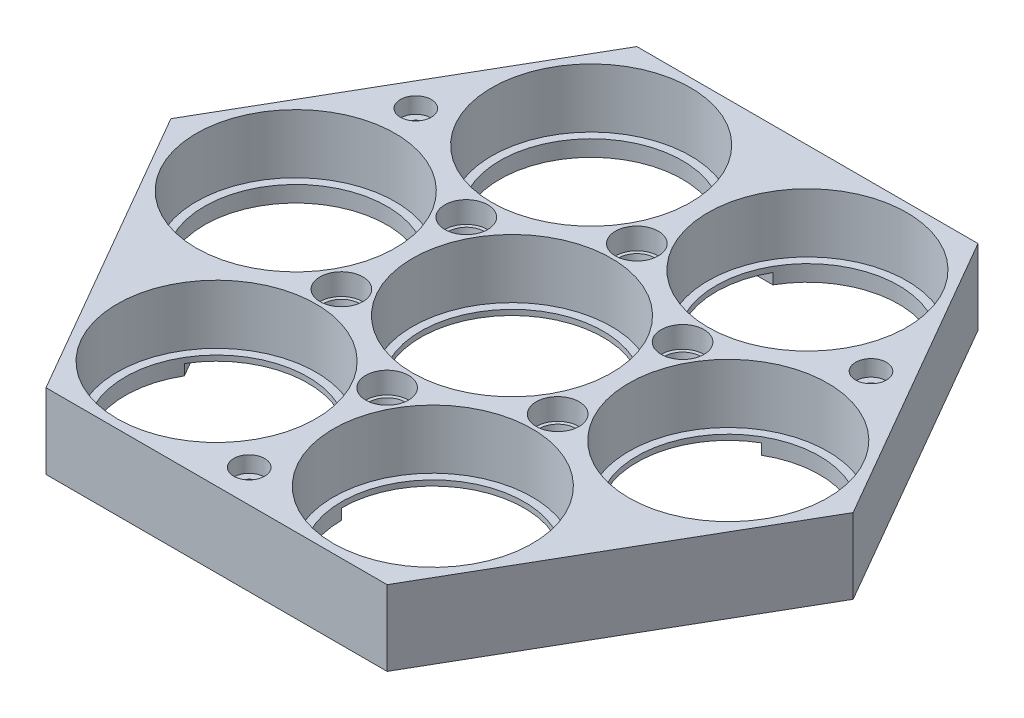
from build123d import *

# Parameters (mm, degrees)
SKETCH1_R                    = 17
BOSS_EXTRUDE1_DEPTH          = 1
SKETCH2_R                    = 18.525
BOSS_EXTRUDE2_DEPTH          = 11
CUT_EXTRUDE1_DEPTH           = 85.943417218
CUT_EXTRUDE1_DEPTH_BACK      = 4
SKETCH3_R                    = 4
SKETCH3_2_R                  = 4
CUT_EXTRUDE2_DEPTH           = 85.943417218
CUT_EXTRUDE2_DRAFT           = -9
CUT_EXTRUDE2_PROFILE_2_DEPTH = 85.943417218
CUT_EXTRUDE2_PROFILE_2_DRAFT = -9
CUT_EXTRUDE2_PROFILE_3_DEPTH = 85.943417218
CUT_EXTRUDE2_PROFILE_3_DRAFT = -9
CUT_EXTRUDE2_PROFILE_4_DEPTH = 85.943417218
CUT_EXTRUDE2_PROFILE_4_DRAFT = -9
CUT_EXTRUDE2_PROFILE_5_DEPTH = 85.943417218
CUT_EXTRUDE2_PROFILE_5_DRAFT = -9
CUT_EXTRUDE2_PROFILE_6_DEPTH = 85.943417218
CUT_EXTRUDE2_PROFILE_6_DRAFT = -9
BOSS_EXTRUDE3_START          = 2
BOSS_EXTRUDE3_DEPTH          = 2
SKETCH7_R                    = 1.55
CUT_EXTRUDE4_DEPTH           = 86.248953828
SKETCH7_3_R                  = 2.875
SKETCH7_3_R_2                = 1.55
CUT_EXTRUDE5_DEPTH           = 3


with BuildPart() as part:
    # Sketch1 → Boss-Extrude1 (new body)
    with BuildSketch(Plane(origin=(0, 0, 0), x_dir=(1, 0, 0), z_dir=(0, 1, 0))):
        Polygon((-31.783607924, -55.050823773), (31.783607924, -55.050823773), (63.567215848, 0), (31.783607924, 55.050823773), (-31.783607924, 55.050823773), (-63.567215848, 0), align=None)
        with Locations(Location((-40.3, 0, 0), (0, 0, 270))):
            Circle(SKETCH1_R, mode=Mode.SUBTRACT)
        with Locations(Location((-20.15, -34.900823773, 0), (0, 0, 270))):
            Circle(SKETCH1_R, mode=Mode.SUBTRACT)
        with Locations(Location((20.15, -34.900823773, 0), (0, 0, 270))):
            Circle(SKETCH1_R, mode=Mode.SUBTRACT)
        with Locations(Location((40.3, 0, 0), (0, 0, 270))):
            Circle(SKETCH1_R, mode=Mode.SUBTRACT)
        with Locations(Location((20.15, 34.900823773, 0), (0, 0, 270))):
            Circle(SKETCH1_R, mode=Mode.SUBTRACT)
        with Locations(Location((-20.15, 34.900823773, 0), (0, 0, 270))):
            Circle(SKETCH1_R, mode=Mode.SUBTRACT)
        with Locations(Location((0, 0, 0), (0, 0, 270))):
            Circle(SKETCH1_R, mode=Mode.SUBTRACT)
    extrude(amount=BOSS_EXTRUDE1_DEPTH)

    # Sketch2 → Boss-Extrude2 (add)
    with BuildSketch(Plane(origin=(0, 1, 0), x_dir=(1, 0, 0), z_dir=(0, 1, 0))):
        Polygon((63.567215848, 0), (31.783607924, 55.050823773), (-31.783607924, 55.050823773), (-63.567215848, 0), (-31.783607924, -55.050823773), (31.783607924, -55.050823773), align=None)
        with Locations(Location((-40.3, 0, 0), (0, 0, 270))):
            Circle(SKETCH2_R, mode=Mode.SUBTRACT)
        with Locations(Location((-20.15, 34.900823773, 0), (0, 0, 270))):
            Circle(SKETCH2_R, mode=Mode.SUBTRACT)
        with Locations(Location((20.15, 34.900823773, 0), (0, 0, 270))):
            Circle(SKETCH2_R, mode=Mode.SUBTRACT)
        with Locations(Location((0, 0, 0), (0, 0, 270))):
            Circle(SKETCH2_R, mode=Mode.SUBTRACT)
        with Locations(Location((40.3, 0, 0), (0, 0, 270))):
            Circle(SKETCH2_R, mode=Mode.SUBTRACT)
        with Locations(Location((20.15, -34.900823773, 0), (0, 0, 270))):
            Circle(SKETCH2_R, mode=Mode.SUBTRACT)
        with Locations(Location((-20.15, -34.900823773, 0), (0, 0, 270))):
            Circle(SKETCH2_R, mode=Mode.SUBTRACT)
    extrude(amount=BOSS_EXTRUDE2_DEPTH)

    # Sketch3 → Cut-Extrude1 (cut, two sides: drawn at the far end of the back side and taken through both)
    with BuildSketch(Plane(origin=(0, 12, 0), x_dir=(1, 0, 0), z_dir=(0, 1, 0)).offset(-CUT_EXTRUDE1_DEPTH_BACK)):
        with Locations(Location((-20.15, 11.633607924, 0), (0, 0, 90))):
            Circle(SKETCH3_R)
        with Locations(Location((20.15, 11.633607924, 0), (0, 0, 90))):
            Circle(SKETCH3_R)
        with Locations(Location((0, -23.267215848, 0), (0, 0, 90))):
            Circle(SKETCH3_R)
        with Locations(Location((-20.15, -11.633607924, 0), (0, 0, 90))):
            Circle(SKETCH3_R)
        with Locations(Location((20.15, -11.633607924, 0), (0, 0, 90))):
            Circle(SKETCH3_R)
        with Locations(Location((0, 23.267215848, 0), (0, 0, 90))):
            Circle(SKETCH3_R)
    extrude(amount=CUT_EXTRUDE1_DEPTH + CUT_EXTRUDE1_DEPTH_BACK, mode=Mode.SUBTRACT)


with BuildPart() as cut_extrude2_tool:
    # Sketch3<2> → Cut-Extrude2 (with draft: the straight prism first)
    with BuildSketch(Plane(origin=(0, 12, 0), x_dir=(1, 0, 0), z_dir=(0, 1, 0))):
        with Locations(Location((-20.15, 11.633607924, 0), (0, 0, 90))):
            Circle(SKETCH3_2_R)
    extrude(amount=-CUT_EXTRUDE2_DEPTH)
    # Cut-Extrude2: the draft: its side faces are tilted about the plane it starts from
    cut_extrude2_sides = [cut_extrude2_tool.faces().sort_by_distance(p)[0] for p in [
        (-20.15, -30.971708609, -7.633607924),
    ]]
    draft(cut_extrude2_sides, Plane(origin=(0, 12, 0), x_dir=(1, 0, 0), z_dir=(0, 1, 0)), CUT_EXTRUDE2_DRAFT)


with BuildPart() as part_1:
    add(part.part)

    # Cut-Extrude2: cut by cut_extrude2_tool
    add(cut_extrude2_tool.part, mode=Mode.SUBTRACT)


with BuildPart() as cut_extrude2_profile_2_tool:
    # Sketch3<2> → Cut-Extrude2 profile 2 (with draft: the straight prism first)
    with BuildSketch(Plane(origin=(0, 12, 0), x_dir=(1, 0, 0), z_dir=(0, 1, 0))):
        with Locations(Location((20.15, 11.633607924, 0), (0, 0, 90))):
            Circle(SKETCH3_2_R)
    extrude(amount=-CUT_EXTRUDE2_PROFILE_2_DEPTH)
    # Cut-Extrude2 profile 2: the draft: its side faces are tilted about the plane it starts from
    cut_extrude2_profile_2_sides = [cut_extrude2_profile_2_tool.faces().sort_by_distance(p)[0] for p in [
        (20.15, -30.971708609, -7.633607924),
    ]]
    draft(cut_extrude2_profile_2_sides, Plane(origin=(0, 12, 0), x_dir=(1, 0, 0), z_dir=(0, 1, 0)), CUT_EXTRUDE2_PROFILE_2_DRAFT)


with BuildPart() as part_2:
    add(part_1.part)

    # Cut-Extrude2 profile 2: cut by cut_extrude2_profile_2_tool
    add(cut_extrude2_profile_2_tool.part, mode=Mode.SUBTRACT)


with BuildPart() as cut_extrude2_profile_3_tool:
    # Sketch3<2> → Cut-Extrude2 profile 3 (with draft: the straight prism first)
    with BuildSketch(Plane(origin=(0, 12, 0), x_dir=(1, 0, 0), z_dir=(0, 1, 0))):
        with Locations(Location((0, -23.267215848, 0), (0, 0, 90))):
            Circle(SKETCH3_2_R)
    extrude(amount=-CUT_EXTRUDE2_PROFILE_3_DEPTH)
    # Cut-Extrude2 profile 3: the draft: its side faces are tilted about the plane it starts from
    cut_extrude2_profile_3_sides = [cut_extrude2_profile_3_tool.faces().sort_by_distance(p)[0] for p in [
        (0, -30.971708609, 27.267215848),
    ]]
    draft(cut_extrude2_profile_3_sides, Plane(origin=(0, 12, 0), x_dir=(1, 0, 0), z_dir=(0, 1, 0)), CUT_EXTRUDE2_PROFILE_3_DRAFT)


with BuildPart() as part_3:
    add(part_2.part)

    # Cut-Extrude2 profile 3: cut by cut_extrude2_profile_3_tool
    add(cut_extrude2_profile_3_tool.part, mode=Mode.SUBTRACT)


with BuildPart() as cut_extrude2_profile_4_tool:
    # Sketch3<2> → Cut-Extrude2 profile 4 (with draft: the straight prism first)
    with BuildSketch(Plane(origin=(0, 12, 0), x_dir=(1, 0, 0), z_dir=(0, 1, 0))):
        with Locations(Location((-20.15, -11.633607924, 0), (0, 0, 90))):
            Circle(SKETCH3_2_R)
    extrude(amount=-CUT_EXTRUDE2_PROFILE_4_DEPTH)
    # Cut-Extrude2 profile 4: the draft: its side faces are tilted about the plane it starts from
    cut_extrude2_profile_4_sides = [cut_extrude2_profile_4_tool.faces().sort_by_distance(p)[0] for p in [
        (-20.15, -30.971708609, 15.633607924),
    ]]
    draft(cut_extrude2_profile_4_sides, Plane(origin=(0, 12, 0), x_dir=(1, 0, 0), z_dir=(0, 1, 0)), CUT_EXTRUDE2_PROFILE_4_DRAFT)


with BuildPart() as part_4:
    add(part_3.part)

    # Cut-Extrude2 profile 4: cut by cut_extrude2_profile_4_tool
    add(cut_extrude2_profile_4_tool.part, mode=Mode.SUBTRACT)


with BuildPart() as cut_extrude2_profile_5_tool:
    # Sketch3<2> → Cut-Extrude2 profile 5 (with draft: the straight prism first)
    with BuildSketch(Plane(origin=(0, 12, 0), x_dir=(1, 0, 0), z_dir=(0, 1, 0))):
        with Locations(Location((20.15, -11.633607924, 0), (0, 0, 90))):
            Circle(SKETCH3_2_R)
    extrude(amount=-CUT_EXTRUDE2_PROFILE_5_DEPTH)
    # Cut-Extrude2 profile 5: the draft: its side faces are tilted about the plane it starts from
    cut_extrude2_profile_5_sides = [cut_extrude2_profile_5_tool.faces().sort_by_distance(p)[0] for p in [
        (20.15, -30.971708609, 15.633607924),
    ]]
    draft(cut_extrude2_profile_5_sides, Plane(origin=(0, 12, 0), x_dir=(1, 0, 0), z_dir=(0, 1, 0)), CUT_EXTRUDE2_PROFILE_5_DRAFT)


with BuildPart() as part_5:
    add(part_4.part)

    # Cut-Extrude2 profile 5: cut by cut_extrude2_profile_5_tool
    add(cut_extrude2_profile_5_tool.part, mode=Mode.SUBTRACT)


with BuildPart() as cut_extrude2_profile_6_tool:
    # Sketch3<2> → Cut-Extrude2 profile 6 (with draft: the straight prism first)
    with BuildSketch(Plane(origin=(0, 12, 0), x_dir=(1, 0, 0), z_dir=(0, 1, 0))):
        with Locations(Location((0, 23.267215848, 0), (0, 0, 90))):
            Circle(SKETCH3_2_R)
    extrude(amount=-CUT_EXTRUDE2_PROFILE_6_DEPTH)
    # Cut-Extrude2 profile 6: the draft: its side faces are tilted about the plane it starts from
    cut_extrude2_profile_6_sides = [cut_extrude2_profile_6_tool.faces().sort_by_distance(p)[0] for p in [
        (0, -30.971708609, -19.267215848),
    ]]
    draft(cut_extrude2_profile_6_sides, Plane(origin=(0, 12, 0), x_dir=(1, 0, 0), z_dir=(0, 1, 0)), CUT_EXTRUDE2_PROFILE_6_DRAFT)


with BuildPart() as part_6:
    add(part_5.part)

    # Cut-Extrude2 profile 6: cut by cut_extrude2_profile_6_tool
    add(cut_extrude2_profile_6_tool.part, mode=Mode.SUBTRACT)

    # Sketch5 → Boss-Extrude3 (add)
    with BuildSketch(Plane.XZ.offset(BOSS_EXTRUDE3_START)):
        with BuildLine():
            Line((-31.783607924, 55.050823773), (-63.567215848, 0))
            Line((-63.567215848, 0), (-57.3, 0))
            ThreePointArc((-57.3, 0), (-52.266288561, 12.075095779), (-40.146124932, 16.999303588))
            Line((-40.146124932, 16.999303588), (-34.794891219, 26.267912261))
            ThreePointArc((-34.794891219, 26.267912261), (-24.624195418, 51.301481545), (-3.15, 34.900823773))
            Line((-3.15, 34.900823773), (3.15, 34.900823773))
            ThreePointArc((3.15, 34.900823773), (11.65, 49.623255637), (28.65, 49.623255637))
            Line((28.65, 49.623255637), (31.783607924, 55.050823773))
            Line((31.783607924, 55.050823773), (-31.783607924, 55.050823773))
        make_face()
        with BuildLine():
            Line((-57.3, 0), (-63.567215848, 0))
            Line((-63.567215848, 0), (-31.783607924, -55.050823773))
            Line((-31.783607924, -55.050823773), (31.783607924, -55.050823773))
            Line((31.783607924, -55.050823773), (28.65, -49.623255637))
            ThreePointArc((28.65, -49.623255637), (15.675804582, -51.301481545), (5.351233712, -43.267215848))
            Line((5.351233712, -43.267215848), (-5.351233712, -43.267215848))
            ThreePointArc((-5.351233712, -43.267215848), (-32.116288561, -46.975919552), (-28.65, -20.178391908))
            Line((-28.65, -20.178391908), (-31.8, -14.722431864))
            ThreePointArc((-31.8, -14.722431864), (-48.8, -14.722431864), (-57.3, 0))
        make_face()
        with BuildLine():
            Line((28.65, -49.623255637), (31.783607924, -55.050823773))
            Line((31.783607924, -55.050823773), (63.567215848, 0))
            Line((63.567215848, 0), (31.783607924, 55.050823773))
            Line((31.783607924, 55.050823773), (28.65, 49.623255637))
            ThreePointArc((28.65, 49.623255637), (34.872431864, 43.400823773), (37.15, 34.900823773))
            ThreePointArc((37.15, 34.900823773), (36.550657772, 30.426628355), (34.794891219, 26.267912261))
            Line((34.794891219, 26.267912261), (40.146124932, 16.999303588))
            ThreePointArc((40.146124932, 16.999303588), (52.266288561, 12.075095779), (57.3, 0))
            ThreePointArc((57.3, 0), (48.8, -14.722431864), (31.8, -14.722431864))
            Line((31.8, -14.722431864), (28.65, -20.178391908))
            ThreePointArc((28.65, -20.178391908), (34.872431864, -26.400823773), (37.15, -34.900823773))
            ThreePointArc((37.15, -34.900823773), (34.872431864, -43.400823773), (28.65, -49.623255637))
        make_face()
    extrude(amount=-BOSS_EXTRUDE3_DEPTH)

    # Sketch7 → Cut-Extrude4 (cut, through all)
    with BuildSketch(Plane(origin=(0, 12, 0), x_dir=(1, 0, 0), z_dir=(0, 1, 0))):
        with Locations(Location((-42.409454211, 24.485109805, 0), (0, 0, 270))):
            Circle(SKETCH7_R)
        with Locations(Location((42.409454211, 24.485109805, 0), (0, 0, 270))):
            Circle(SKETCH7_R)
        with Locations(Location((0, -48.97021961, 0), (0, 0, 270))):
            Circle(SKETCH7_R)
    extrude(amount=-CUT_EXTRUDE4_DEPTH, mode=Mode.SUBTRACT)

    # Sketch7<3> → Cut-Extrude5 (cut)
    # profile 1 of 3: a face of its own
    with BuildSketch(Plane(origin=(0, 12, 0), x_dir=(1, 0, 0), z_dir=(0, 1, 0))):
        with Locations(Location((-42.409454211, 24.485109805, 0), (0, 0, 270))):
            Circle(SKETCH7_3_R)
        with Locations(Location((-42.409454211, 24.485109805, 0), (0, 0, 270))):
            Circle(SKETCH7_3_R_2, mode=Mode.SUBTRACT)
    # profile 2 of 3: a face of its own
    with BuildSketch(Plane(origin=(0, 12, 0), x_dir=(1, 0, 0), z_dir=(0, 1, 0))):
        with Locations(Location((42.409454211, 24.485109805, 0), (0, 0, 270))):
            Circle(SKETCH7_3_R)
    # profile 3 of 3: a face of its own
    with BuildSketch(Plane(origin=(0, 12, 0), x_dir=(1, 0, 0), z_dir=(0, 1, 0))):
        with Locations(Location((0, -48.97021961, 0), (0, 0, 270))):
            Circle(SKETCH7_3_R)
    extrude(amount=-CUT_EXTRUDE5_DEPTH, mode=Mode.SUBTRACT)


solid = part_6.part
